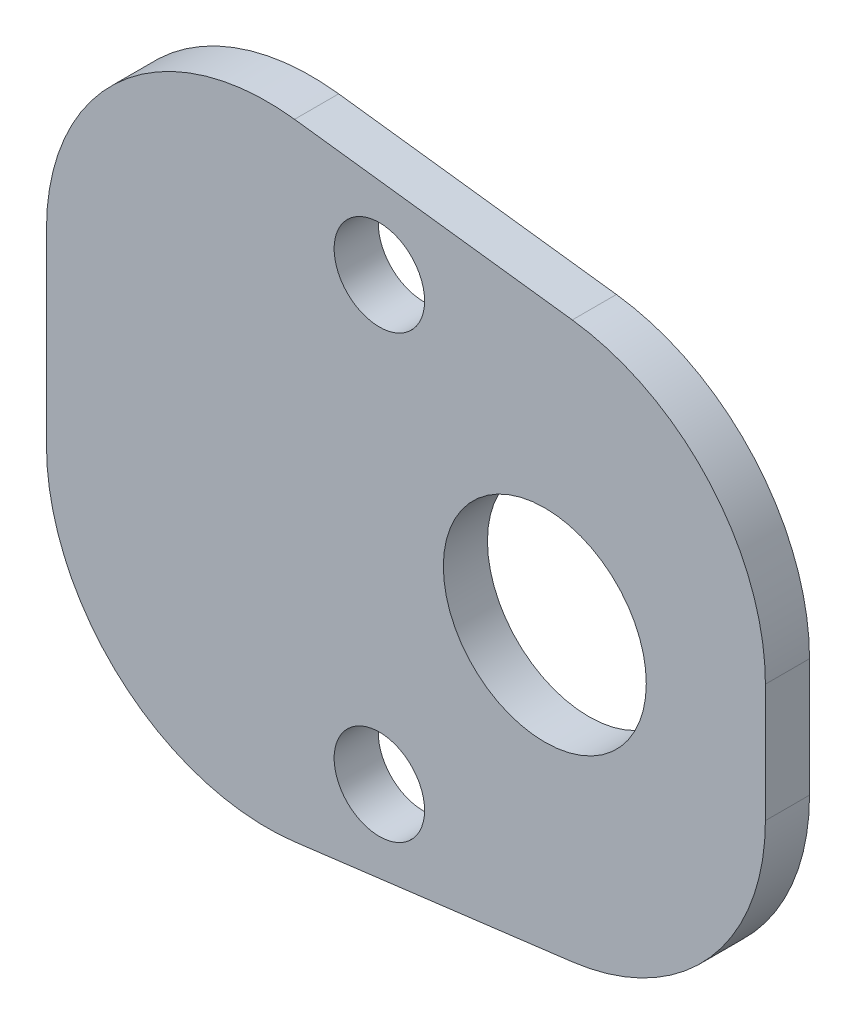
from build123d import *

# Parameters (mm, degrees)
SKETCH_1_R      = 2.05
SKETCH_1_R_2    = 4.6
EXTRUDE_1_DEPTH = 2


with BuildPart() as part:
    # 草图1 → 凸台-拉伸1 (new body)
    with BuildSketch(Plane.XY):
        with BuildLine():
            Line((-3.753096947, 12.600241703), (-16.343310644, 14.181172272))
            ThreePointArc((-16.343310644, 14.181172272), (-24.205137287, 11.757721557), (-27.589208865, 4.259088942))
            Line((-27.589208865, 4.259088942), (-27.589208865, -4.259088942))
            ThreePointArc((-27.589208865, -4.259088942), (-24.205137287, -11.757721557), (-16.343310644, -14.181172272))
            Line((-16.343310644, -14.181172272), (-3.753096947, -12.600241703))
            ThreePointArc((-3.753096947, -12.600241703), (2.499637447, -9.294086795), (5.001004832, -2.678158372))
            Line((5.001004832, -2.678158372), (5.001004832, 2.678158372))
            ThreePointArc((5.001004832, 2.678158372), (2.499637447, 9.294086795), (-3.753096947, 12.600241703))
        make_face()
        with Locations((-12.498995168, 10)):
            Circle(SKETCH_1_R, mode=Mode.SUBTRACT)
        with Locations((-4.998995168, 0)):
            Circle(SKETCH_1_R_2, mode=Mode.SUBTRACT)
        with Locations((-12.498995168, -10)):
            Circle(SKETCH_1_R, mode=Mode.SUBTRACT)
    extrude(amount=EXTRUDE_1_DEPTH)


solid = part.part
